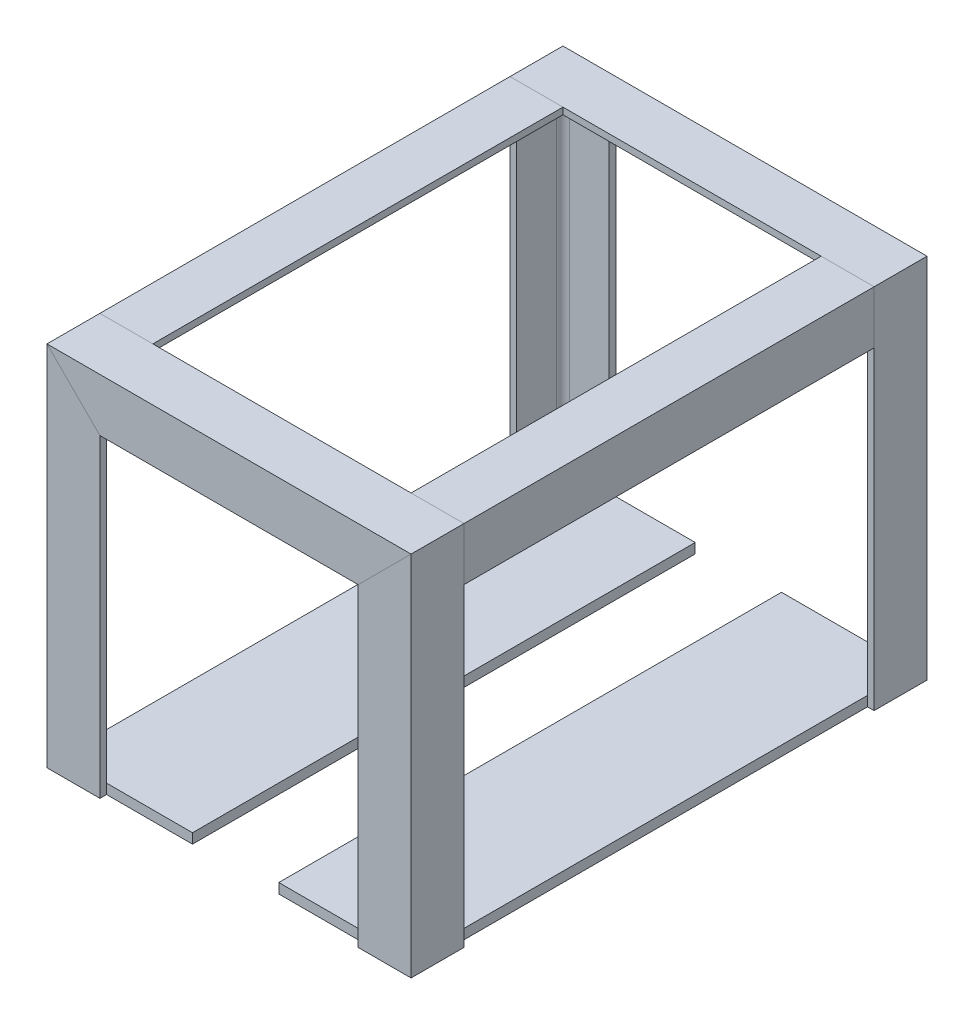
from build123d import *

# Parameters (mm, degrees)
NGULO_DE_EXTREMOS_CUADRADOS_AL_LS_AL_LS_DEPTH       = 262.473024484
NGULO_DE_EXTREMOS_CUADRADOS_AL_LS_AL_3_DEPTH        = 248.594048969
NGULO_DE_EXTREMOS_CUADRADOS_AL_LS_AL_5_DEPTH        = 262.473024484
NGULO_DE_EXTREMOS_CUADRADOS_AL_LS_AL_6_DEPTH        = 262.473024484
NGULO_DE_EXTREMOS_CUADRADOS_AL_LS_AL_6_2_DEPTH      = 248.594048969
NGULO_DE_EXTREMOS_CUADRADOS_AL_LS_AL_6_3_DEPTH      = 36.921024484
NGULO_DE_EXTREMOS_CUADRADOS_AL_LS_AL_6_3_DEPTH_BACK = 225.552
NGULO_DE_EXTREMOS_CUADRADOS_AL_LS_AL_10_DEPTH       = 196.85
NGULO_DE_EXTREMOS_CUADRADOS_AL_LS_AL_11_DEPTH       = 196.85
SALIENTE_EXTRUIR1_DEPTH                             = 4.7625
SALIENTE_EXTRUIR1_2_DEPTH                           = 4.7625
CROQUIS4_W                                          = 247.65
CROQUIS4_H                                          = 49.3395
CORTAR_EXTRUIR1_DEPTH                               = 378.812769382


with BuildPart() as part:
    # Sketch1 → ngulo de extremos cuadrados al ls AL LS (new body)
    with BuildSketch(Plane.XZ):
        with BuildLine():
            Line((0, 0), (0, 25.4))
            Line((0, 25.4), (3.175, 25.4))
            Line((3.175, 25.4), (3.175, 6.35))
            ThreePointArc((3.175, 6.35), (4.10493597, 4.10493597), (6.35, 3.175))
            Line((6.35, 3.175), (25.4, 3.175))
            Line((25.4, 3.175), (25.4, 0))
            Line((25.4, 0), (0, 0))
        make_face()
    extrude(amount=-NGULO_DE_EXTREMOS_CUADRADOS_AL_LS_AL_LS_DEPTH)

    # ngulo de extremos cuadrados al ls AL 2
    split(bisect_by=Plane(origin=(0, 225.552, 0), x_dir=(0.707106781, -0.707106781, 0), z_dir=(-0.707106781, -0.707106781, 0)), keep=Keep.TOP)


with BuildPart() as body_2:
    # Sketch1 on segment 2 (carried to segment 2) → ngulo de extremos cuadrados al ls AL 3 (new body)
    with BuildSketch(Plane(origin=(211.673024484, 225.552, 0), x_dir=(0, -1, 0), z_dir=(-1, 0, 0))):
        with BuildLine():
            Line((0, 0), (0, 25.4))
            Line((0, 25.4), (3.175, 25.4))
            Line((3.175, 25.4), (3.175, 6.35))
            ThreePointArc((3.175, 6.35), (4.10493597, 4.10493597), (6.35, 3.175))
            Line((6.35, 3.175), (25.4, 3.175))
            Line((25.4, 3.175), (25.4, 0))
            Line((25.4, 0), (0, 0))
        make_face()
    extrude(amount=NGULO_DE_EXTREMOS_CUADRADOS_AL_LS_AL_3_DEPTH)

    # ngulo de extremos cuadrados al ls AL 3 m
    split(bisect_by=Plane(origin=(0, 225.552, 0), x_dir=(-0.707106781, 0.707106781, 0), z_dir=(0.707106781, 0.707106781, 0)), keep=Keep.TOP)

    # ngulo de extremos cuadrados al ls AL 4
    split(bisect_by=Plane(origin=(174.752, 225.552, 0), x_dir=(-0.707106781, -0.707106781, 0), z_dir=(-0.707106781, 0.707106781, 0)), keep=Keep.TOP)


with BuildPart() as body_3:
    # Sketch1 on segment 3 (carried to segment 3) → ngulo de extremos cuadrados al ls AL 5 (new body)
    with BuildSketch(Plane(origin=(174.752, 0, 0), x_dir=(-1, 0, 0), z_dir=(0, 1, 0))):
        with BuildLine():
            Line((0, 0), (0, 25.4))
            Line((0, 25.4), (3.175, 25.4))
            Line((3.175, 25.4), (3.175, 6.35))
            ThreePointArc((3.175, 6.35), (4.10493597, 4.10493597), (6.35, 3.175))
            Line((6.35, 3.175), (25.4, 3.175))
            Line((25.4, 3.175), (25.4, 0))
            Line((25.4, 0), (0, 0))
        make_face()
    extrude(amount=NGULO_DE_EXTREMOS_CUADRADOS_AL_LS_AL_5_DEPTH)

    # ngulo de extremos cuadrados al ls AL 5 m
    split(bisect_by=Plane(origin=(174.752, 225.552, 0), x_dir=(0.707106781, 0.707106781, 0), z_dir=(0.707106781, -0.707106781, 0)), keep=Keep.TOP)


with BuildPart() as body_4:
    # Sketch12 on segment 1 (carried to segment 1) → ngulo de extremos cuadrados al ls AL 6 (new body)
    with BuildSketch(Plane(origin=(0, 262.473024484, 247.65), x_dir=(0, 0, -1), z_dir=(0, -1, 0))):
        with BuildLine():
            Line((0, 0), (0, 25.4))
            Line((0, 25.4), (3.175, 25.4))
            Line((3.175, 25.4), (3.175, 6.35))
            ThreePointArc((3.175, 6.35), (4.10493597, 4.10493597), (6.35, 3.175))
            Line((6.35, 3.175), (25.4, 3.175))
            Line((25.4, 3.175), (25.4, 0))
            Line((25.4, 0), (0, 0))
        make_face()
    extrude(amount=NGULO_DE_EXTREMOS_CUADRADOS_AL_LS_AL_6_DEPTH)

    # ngulo de extremos cuadrados al ls AL 6 m
    split(bisect_by=Plane(origin=(0, 225.552, 247.65), x_dir=(0.707106781, -0.707106781, 0), z_dir=(-0.707106781, -0.707106781, 0)), keep=Keep.TOP)


with BuildPart() as body_5:
    # Sketch12 on segment 2 (carried to segment 2) → ngulo de extremos cuadrados al ls AL 6 2 (new body)
    with BuildSketch(Plane(origin=(211.673024484, 225.552, 247.65), x_dir=(0, 0, -1), z_dir=(-1, 0, 0))):
        with BuildLine():
            Line((0, 0), (0, 25.4))
            Line((0, 25.4), (3.175, 25.4))
            Line((3.175, 25.4), (3.175, 6.35))
            ThreePointArc((3.175, 6.35), (4.10493597, 4.10493597), (6.35, 3.175))
            Line((6.35, 3.175), (25.4, 3.175))
            Line((25.4, 3.175), (25.4, 0))
            Line((25.4, 0), (0, 0))
        make_face()
    extrude(amount=NGULO_DE_EXTREMOS_CUADRADOS_AL_LS_AL_6_2_DEPTH)

    # ngulo de extremos cuadrados al ls AL 7
    split(bisect_by=Plane(origin=(0, 225.552, 247.65), x_dir=(-0.707106781, 0.707106781, 0), z_dir=(0.707106781, 0.707106781, 0)), keep=Keep.TOP)

    # ngulo de extremos cuadrados al ls AL 8
    split(bisect_by=Plane(origin=(174.752, 225.552, 247.65), x_dir=(-0.707106781, -0.707106781, 0), z_dir=(-0.707106781, 0.707106781, 0)), keep=Keep.TOP)


with BuildPart() as body_6:
    # Sketch12 → ngulo de extremos cuadrados al ls AL 6 3 (new, two sides: drawn at the far end of the back side and taken through both)
    with BuildSketch(Plane(origin=(174.752, 225.552, 247.65), x_dir=(0, 0, -1), z_dir=(0, 1, 0)).offset(-NGULO_DE_EXTREMOS_CUADRADOS_AL_LS_AL_6_3_DEPTH_BACK)):
        with BuildLine():
            Line((0, 0), (0, 25.4))
            Line((0, 25.4), (3.175, 25.4))
            Line((3.175, 25.4), (3.175, 6.35))
            ThreePointArc((3.175, 6.35), (4.10493597, 4.10493597), (6.35, 3.175))
            Line((6.35, 3.175), (25.4, 3.175))
            Line((25.4, 3.175), (25.4, 0))
            Line((25.4, 0), (0, 0))
        make_face()
    extrude(amount=NGULO_DE_EXTREMOS_CUADRADOS_AL_LS_AL_6_3_DEPTH + NGULO_DE_EXTREMOS_CUADRADOS_AL_LS_AL_6_3_DEPTH_BACK)

    # ngulo de extremos cuadrados al ls AL 9
    split(bisect_by=Plane(origin=(174.752, 225.552, 247.65), x_dir=(0.707106781, 0.707106781, 0), z_dir=(0.707106781, -0.707106781, 0)), keep=Keep.TOP)


with BuildPart() as body_7:
    # Sketch13 → ngulo de extremos cuadrados al ls AL 10 (new body)
    with BuildSketch(Plane(origin=(174.752, 225.552, 25.4), x_dir=(-1, 0, 0), z_dir=(0, 0, 1))):
        with BuildLine():
            Line((0, 0), (0, 25.4))
            Line((0, 25.4), (3.175, 25.4))
            Line((3.175, 25.4), (3.175, 6.35))
            ThreePointArc((3.175, 6.35), (4.10493597, 4.10493597), (6.35, 3.175))
            Line((6.35, 3.175), (25.4, 3.175))
            Line((25.4, 3.175), (25.4, 0))
            Line((25.4, 0), (0, 0))
        make_face()
    extrude(amount=NGULO_DE_EXTREMOS_CUADRADOS_AL_LS_AL_10_DEPTH)


with BuildPart() as body_8:
    # Sketch14 → ngulo de extremos cuadrados al ls AL 11 (new body)
    with BuildSketch(Plane(origin=(0, 225.552, 222.25), x_dir=(1, 0, 0), z_dir=(0, 0, -1))):
        with BuildLine():
            Line((0, 0), (0, 25.4))
            Line((0, 25.4), (3.175, 25.4))
            Line((3.175, 25.4), (3.175, 6.35))
            ThreePointArc((3.175, 6.35), (4.10493597, 4.10493597), (6.35, 3.175))
            Line((6.35, 3.175), (25.4, 3.175))
            Line((25.4, 3.175), (25.4, 0))
            Line((25.4, 0), (0, 0))
        make_face()
    extrude(amount=NGULO_DE_EXTREMOS_CUADRADOS_AL_LS_AL_11_DEPTH)


with BuildPart() as body_9:
    # Croquis3 → Saliente-Extruir1 (new body)
    with BuildSketch(Plane(origin=(0, 54.102, 0), x_dir=(-1, 0, 0), z_dir=(0, -1, 0))):
        with BuildLine():
            Line((-168.402, -244.475), (-108.077, -244.475))
            Line((-108.077, -244.475), (-108.077, -3.175))
            Line((-108.077, -3.175), (-168.402, -3.175))
            ThreePointArc((-168.402, -3.175), (-170.64706403, -4.10493597), (-171.577, -6.35))
            Line((-171.577, -6.35), (-171.577, -241.3))
            ThreePointArc((-171.577, -241.3), (-170.64706403, -243.54506403), (-168.402, -244.475))
        make_face()
    extrude(amount=SALIENTE_EXTRUIR1_DEPTH)


with BuildPart() as body_10:
    # Croquis3 → Saliente-Extruir1 2 (new body)
    with BuildSketch(Plane(origin=(0, 54.102, 0), x_dir=(-1, 0, 0), z_dir=(0, -1, 0))):
        with BuildLine():
            Line((-66.675, -3.175), (-6.35, -3.175))
            ThreePointArc((-6.35, -3.175), (-4.10493597, -4.10493597), (-3.175, -6.35))
            Line((-3.175, -6.35), (-3.175, -241.3))
            ThreePointArc((-3.175, -241.3), (-4.10493597, -243.54506403), (-6.35, -244.475))
            Line((-6.35, -244.475), (-66.675, -244.475))
            Line((-66.675, -244.475), (-66.675, -3.175))
        make_face()
    extrude(amount=SALIENTE_EXTRUIR1_2_DEPTH)


with BuildPart() as cortar_extruir1_tool:
    # Croquis4 → Cortar-Extruir1 (new, through all)
    with BuildSketch(Plane.ZY):
        with Locations((123.825, 24.66975)):
            Rectangle(CROQUIS4_W, CROQUIS4_H)
    extrude(amount=-CORTAR_EXTRUIR1_DEPTH)


with BuildPart() as part_1:
    add(part.part)

    # Cortar-Extruir1: cut by cortar_extruir1_tool
    add(cortar_extruir1_tool.part, mode=Mode.SUBTRACT)


with BuildPart() as body_3_1:
    add(body_3.part)

    # Cortar-Extruir1: cut by cortar_extruir1_tool
    add(cortar_extruir1_tool.part, mode=Mode.SUBTRACT)


with BuildPart() as body_4_1:
    add(body_4.part)

    # Cortar-Extruir1: cut by cortar_extruir1_tool
    add(cortar_extruir1_tool.part, mode=Mode.SUBTRACT)


with BuildPart() as body_6_1:
    add(body_6.part)

    # Cortar-Extruir1: cut by cortar_extruir1_tool
    add(cortar_extruir1_tool.part, mode=Mode.SUBTRACT)


solid = Compound([body_2.part, body_5.part, body_7.part, body_8.part, body_9.part, body_10.part, part_1.part, body_3_1.part, body_4_1.part, body_6_1.part])
